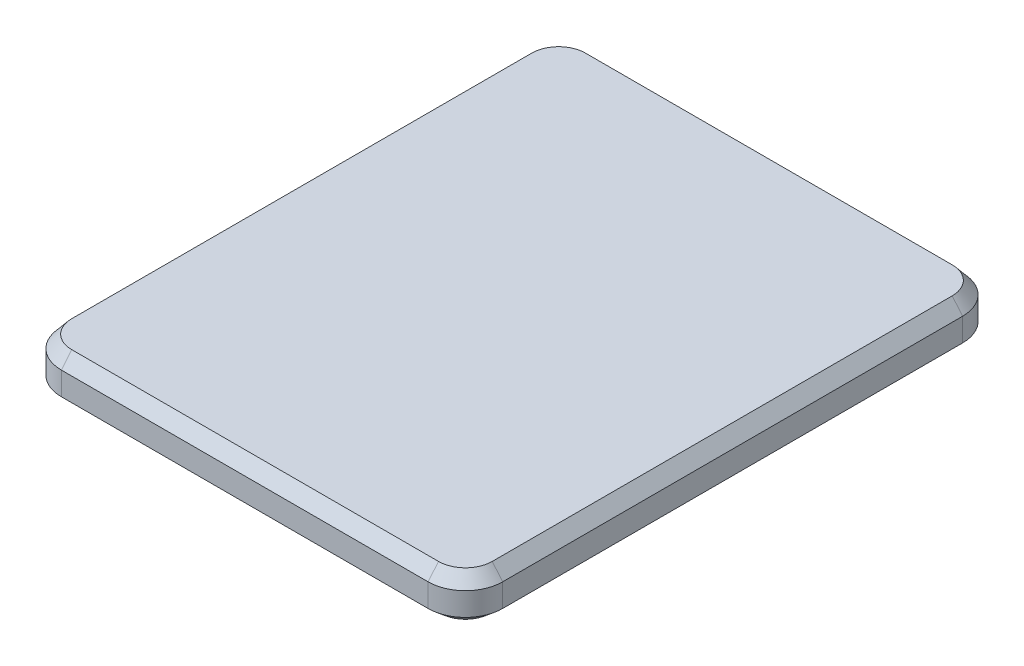
from build123d import *
from OCP.BRepFilletAPI import BRepFilletAPI_MakeChamfer

# Parameters (mm, degrees)
SKETCH_1_W      = 35.5
SKETCH_1_H      = 43
EXTRUDE_1_DEPTH = 3.7
FILLET_1_R      = 3
CHAMFER_1_SIZE  = 1
CHAMFER_1_SIZE2 = 0.839099631


with BuildPart() as part:
    # Эскиз1 → Бобышка-Вытянуть1 (new body)
    with BuildSketch(Plane(origin=(0, 0, 0), x_dir=(1, 0, 0), z_dir=(0, 1, 0))):
        Rectangle(SKETCH_1_W, SKETCH_1_H)
    extrude(amount=EXTRUDE_1_DEPTH)

    # Скругление1
    fillet_1_edges = [part.edges().sort_by_distance(p)[0] for p in [
        (17.75, 1.85, 21.5),
        (-17.75, 1.85, 21.5),
        (-17.75, 1.85, -21.5),
        (17.75, 1.85, -21.5),
    ]]
    fillet(fillet_1_edges, radius=FILLET_1_R)

    # Фаска1: one chamfer whose edges measure the first distance from different faces: ONE call of the kernel's chamfer builder (chamfer() names one face for all edges)
    chamfer_1_edges_1 = [part.edges().sort_by_distance(p)[0] for p in [
        (-17.75, 0, 0),
        (17.75, 0, 0),
        (0, 0, 21.5),
        (0, 0, -21.5),
        (-16.871320344, 0, 20.621320344),
        (16.871320344, 0, 20.621320344),
        (16.871320344, 0, -20.621320344),
        (-16.871320344, 0, -20.621320344),
    ]]
    chamfer_1_side_1 = [part.faces().sort_by_distance(p)[0] for p in [
        (0, 0, 0),
    ]]
    chamfer_1_edges_2 = [part.edges().sort_by_distance(p)[0] for p in [
        (-17.75, 3.7, 0),
    ]]
    chamfer_1_side_2 = [part.faces().sort_by_distance(p)[0] for p in [
        (-17.75, 1.85, 0),
    ]]
    chamfer_1_edges_3 = [part.edges().sort_by_distance(p)[0] for p in [
        (0, 3.7, -21.5),
    ]]
    chamfer_1_side_3 = [part.faces().sort_by_distance(p)[0] for p in [
        (0, 1.85, -21.5),
    ]]
    chamfer_1_edges_4 = [part.edges().sort_by_distance(p)[0] for p in [
        (17.75, 3.7, 0),
    ]]
    chamfer_1_side_4 = [part.faces().sort_by_distance(p)[0] for p in [
        (17.75, 1.85, 0),
    ]]
    chamfer_1_edges_5 = [part.edges().sort_by_distance(p)[0] for p in [
        (0, 3.7, 21.5),
    ]]
    chamfer_1_side_5 = [part.faces().sort_by_distance(p)[0] for p in [
        (0, 1.85, 21.5),
    ]]
    chamfer_1_edges_6 = [part.edges().sort_by_distance(p)[0] for p in [
        (-16.871320344, 3.7, 20.621320344),
    ]]
    chamfer_1_side_6 = [part.faces().sort_by_distance(p)[0] for p in [
        (-16.871320344, 1.85, 20.621320344),
    ]]
    chamfer_1_edges_7 = [part.edges().sort_by_distance(p)[0] for p in [
        (16.871320344, 3.7, 20.621320344),
    ]]
    chamfer_1_side_7 = [part.faces().sort_by_distance(p)[0] for p in [
        (16.871320344, 1.85, 20.621320344),
    ]]
    chamfer_1_edges_8 = [part.edges().sort_by_distance(p)[0] for p in [
        (16.871320344, 3.7, -20.621320344),
    ]]
    chamfer_1_side_8 = [part.faces().sort_by_distance(p)[0] for p in [
        (16.871320344, 1.85, -20.621320344),
    ]]
    chamfer_1_edges_9 = [part.edges().sort_by_distance(p)[0] for p in [
        (-16.871320344, 3.7, -20.621320344),
    ]]
    chamfer_1_side_9 = [part.faces().sort_by_distance(p)[0] for p in [
        (-16.871320344, 1.85, -20.621320344),
    ]]
    chamfer_1 = BRepFilletAPI_MakeChamfer(part.part.solid().wrapped)
    for e in chamfer_1_edges_1:
        chamfer_1.Add(CHAMFER_1_SIZE, CHAMFER_1_SIZE2, e.wrapped, chamfer_1_side_1[0].wrapped)  # the first distance lies on this face
    for e in chamfer_1_edges_2:
        chamfer_1.Add(CHAMFER_1_SIZE, CHAMFER_1_SIZE2, e.wrapped, chamfer_1_side_2[0].wrapped)  # the first distance lies on this face
    for e in chamfer_1_edges_3:
        chamfer_1.Add(CHAMFER_1_SIZE, CHAMFER_1_SIZE2, e.wrapped, chamfer_1_side_3[0].wrapped)  # the first distance lies on this face
    for e in chamfer_1_edges_4:
        chamfer_1.Add(CHAMFER_1_SIZE, CHAMFER_1_SIZE2, e.wrapped, chamfer_1_side_4[0].wrapped)  # the first distance lies on this face
    for e in chamfer_1_edges_5:
        chamfer_1.Add(CHAMFER_1_SIZE, CHAMFER_1_SIZE2, e.wrapped, chamfer_1_side_5[0].wrapped)  # the first distance lies on this face
    for e in chamfer_1_edges_6:
        chamfer_1.Add(CHAMFER_1_SIZE, CHAMFER_1_SIZE2, e.wrapped, chamfer_1_side_6[0].wrapped)  # the first distance lies on this face
    for e in chamfer_1_edges_7:
        chamfer_1.Add(CHAMFER_1_SIZE, CHAMFER_1_SIZE2, e.wrapped, chamfer_1_side_7[0].wrapped)  # the first distance lies on this face
    for e in chamfer_1_edges_8:
        chamfer_1.Add(CHAMFER_1_SIZE, CHAMFER_1_SIZE2, e.wrapped, chamfer_1_side_8[0].wrapped)  # the first distance lies on this face
    for e in chamfer_1_edges_9:
        chamfer_1.Add(CHAMFER_1_SIZE, CHAMFER_1_SIZE2, e.wrapped, chamfer_1_side_9[0].wrapped)  # the first distance lies on this face
    add(Compound.cast(chamfer_1.Shape()), mode=Mode.REPLACE)


solid = part.part
